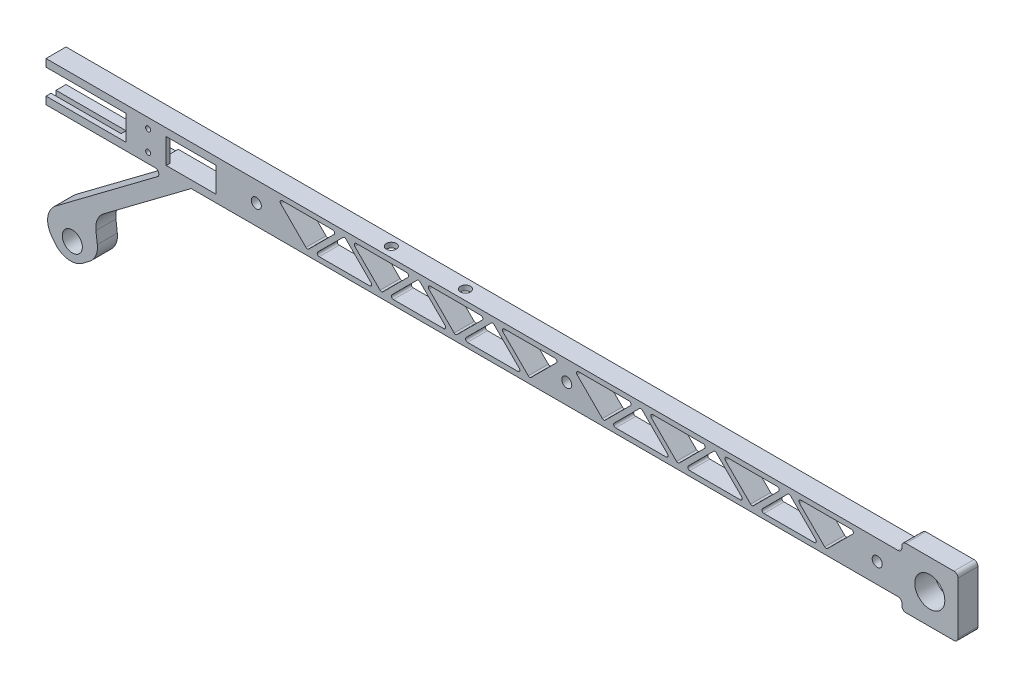
from build123d import *

# Parameters (mm, degrees)
BOSS_EXTRUDE1_DEPTH             = 12.7
CUT_EXTRUDE1_DEPTH              = 12.7
LPATTERN1_COUNT                 = 7
LPATTERN1_PITCH                 = 46.99
CUT_EXTRUDE2_DEPTH              = 12.7
LPATTERN2_COUNT                 = 8
LPATTERN2_PITCH                 = 46.99
BOSS_EXTRUDE3_DEPTH             = 12.7
SKETCH14_R                      = 3.175
CUT_EXTRUDE5_DEPTH              = 577.697477019
SKETCH15_W                      = 50.8
SKETCH15_H                      = 15.875
CUT_EXTRUDE6_DEPTH              = 577.697477019
SKETCH16_W                      = 3.175
SKETCH16_H                      = 22.225
CUT_EXTRUDE7_DEPTH              = 44.45
CUT_EXTRUDE8_DEPTH              = 10.16
SKETCH18_W                      = 31.75
SKETCH18_H                      = 15.875
CUT_EXTRUDE9_DEPTH              = 2.54
F_1_8_0_125_DIAMETER_HOLE1_D    = 3.175
BOSS_EXTRUDE4_DEPTH             = 12.7
F_1_4_0_25_DIAMETER_HOLE1_D     = 6.35
F_1_4_0_25_DIAMETER_HOLE2_D     = 6.35
F_1_4_0_25_DIAMETER_HOLE2_DEPTH = 3.175
F_1_4_0_25_DIAMETER_HOLE2_TIP   = 1.907732465
CUT_EXTRUDE10_DEPTH             = 12.7
SKETCH28_R                      = 6.35
BOSS_EXTRUDE5_DEPTH             = 12.7
CUT_EXTRUDE11_DEPTH             = 12.7
FILLET1_R                       = 12.7
BOSS_EXTRUDE7_START             = -12.7
SKETCH30_R                      = 3.175
BOSS_EXTRUDE7_DEPTH             = 12.7
SKETCH31_R                      = 9.525
CUT_EXTRUDE12_DEPTH             = 12.7
FILLET2_R                       = 2.54
FILLET5_R                       = 2.54


with BuildPart() as part:
    # Sketch1 → Boss-Extrude1 (new body)
    with BuildSketch(Plane.XY):
        with BuildLine():
            Line((2.54, 0), (568.96, 0))
            ThreePointArc((568.96, 0), (570.756051224, 0.743948776), (571.5, 2.54))
            Line((571.5, 2.54), (571.5, 22.86))
            ThreePointArc((571.5, 22.86), (570.756051224, 24.656051224), (568.96, 25.4))
            Line((568.96, 25.4), (2.54, 25.4))
            Line((2.54, 25.4), (0, 25.4))
            Line((0, 25.4), (0, 22.86))
            Line((0, 22.86), (0, 2.54))
            Line((0, 2.54), (0, 0))
            Line((0, 0), (2.54, 0))
        make_face()
    extrude(amount=BOSS_EXTRUDE1_DEPTH)

    # Sketch2 → Cut-Extrude1 (cut)
    with BuildSketch(Plane.XY):
        with BuildLine():
            Line((173.246051224, 3.175), (205.213948776, 3.175))
            ThreePointArc((205.213948776, 3.175), (206.387275782, 3.958992041), (206.111974388, 5.343025612))
            Line((206.111974388, 5.343025612), (190.128025612, 21.326974388))
            ThreePointArc((190.128025612, 21.326974388), (189.23, 21.698948776), (188.331974388, 21.326974388))
            Line((188.331974388, 21.326974388), (172.348025612, 5.343025612))
            ThreePointArc((172.348025612, 5.343025612), (172.072724218, 3.958992041), (173.246051224, 3.175))
        make_face()
    cut_extrude1 = extrude(amount=CUT_EXTRUDE1_DEPTH, mode=Mode.SUBTRACT)

    # LPattern1: Cut-Extrude1 ×7, 1 skipped
    with Locations(*[(i * LPATTERN1_PITCH, 0, 0) for i in range(1, LPATTERN1_COUNT) if i not in (3,)]):
        add(cut_extrude1, mode=Mode.SUBTRACT)

    # Sketch3 → Cut-Extrude2 (cut)
    with BuildSketch(Plane.XY):
        with BuildLine():
            Line((149.751051224, 22.225), (181.718948776, 22.225))
            ThreePointArc((181.718948776, 22.225), (182.892275782, 21.441007959), (182.616974388, 20.056974388))
            Line((182.616974388, 20.056974388), (166.633025612, 4.073025612))
            ThreePointArc((166.633025612, 4.073025612), (165.735, 3.701051224), (164.836974388, 4.073025612))
            Line((164.836974388, 4.073025612), (148.853025612, 20.056974388))
            ThreePointArc((148.853025612, 20.056974388), (148.577724218, 21.441007959), (149.751051224, 22.225))
        make_face()
    cut_extrude2 = extrude(amount=CUT_EXTRUDE2_DEPTH, mode=Mode.SUBTRACT)

    # LPattern2: Cut-Extrude2 ×8
    with Locations(*[(i * LPATTERN2_PITCH, 0, 0) for i in range(1, LPATTERN2_COUNT)]):
        add(cut_extrude2, mode=Mode.SUBTRACT)

    # Sketch8 → Boss-Extrude3 (add)
    with BuildSketch(Plane.XY):
        Polygon((92.075, 0), (-9.525, -76.2), (-15.24, -68.58), (76.2, 0), align=None)
    extrude(amount=BOSS_EXTRUDE3_DEPTH)

    # Sketch14 → Cut-Extrude5 (cut, through all)
    with BuildSketch(Plane(origin=(0, 0, 0), x_dir=(-1, 0, 0), z_dir=(0, 0, -1))):
        with Locations((-560.3875, 12.7)):
            Circle(SKETCH14_R)
    extrude(amount=-CUT_EXTRUDE5_DEPTH, mode=Mode.SUBTRACT)

    # Sketch15 → Cut-Extrude6 (cut, through all)
    with BuildSketch(Plane.XY.offset(12.7)):
        with Locations((25.4, 12.7)):
            Rectangle(SKETCH15_W, SKETCH15_H)
    extrude(amount=-CUT_EXTRUDE6_DEPTH, mode=Mode.SUBTRACT)

    # Sketch16 → Cut-Extrude7 (cut)
    with BuildSketch(Plane.ZY):
        with Locations((7.9375, 12.7)):
            Rectangle(SKETCH16_W, SKETCH16_H)
    extrude(amount=-CUT_EXTRUDE7_DEPTH, mode=Mode.SUBTRACT)

    # Sketch17 → Cut-Extrude8 (cut)
    with BuildSketch(Plane.XY):
        Polygon((50.8, 20.6375), (54.61, 20.6375), (55.88, 22.2885), (71.12, 22.2885), (71.12, 20.6375), (107.95, 20.6375), (107.95, 4.7625), (71.12, 4.7625), (71.12, 3.1115), (55.88, 3.1115), (54.61, 4.7625), (50.8, 4.7625), align=None)
    extrude(amount=CUT_EXTRUDE8_DEPTH, mode=Mode.SUBTRACT)

    # Sketch18 → Cut-Extrude9 (cut)
    with BuildSketch(Plane(origin=(0, 0, 10.16), x_dir=(-1, 0, 0), z_dir=(0, 0, -1))):
        with Locations((-92.075, 12.7)):
            Rectangle(SKETCH18_W, SKETCH18_H)
    extrude(amount=-CUT_EXTRUDE9_DEPTH, mode=Mode.SUBTRACT)

    # 1/8 (0.125) Diameter Hole1 (through all)
    with Locations(Plane(origin=(0, 0, 10.16), x_dir=(-1, 0, 0), z_dir=(0, 0, -1))):
        with Locations((-64.77, 19.1135), (-64.77, 6.2865)):
            Hole(F_1_8_0_125_DIAMETER_HOLE1_D / 2)

    # Sketch21 → Boss-Extrude4 (add)
    with BuildSketch(Plane(origin=(0, 0, 0), x_dir=(-1, 0, 0), z_dir=(0, 0, -1))):
        with BuildLine():
            Line((-76.2, 0), (-69.85, 0))
            ThreePointArc((-69.85, 0), (-71.419048922, -1.593650359), (-71.12, -3.81))
            Line((-71.12, -3.81), (-76.2, 0))
        make_face()
    extrude(amount=-BOSS_EXTRUDE4_DEPTH)

    # 1/4 (0.25) Diameter Hole1 (through all)
    with Locations(Plane.XY.offset(12.7)):
        with Locations((133.35, 12.7), (330.2, 12.7), (527.05, 12.7)):
            Hole(F_1_4_0_25_DIAMETER_HOLE1_D / 2)

    # 1/4 (0.25) Diameter Hole2
    with Locations(Plane(origin=(0, 25.4, 0), x_dir=(1, 0, 0), z_dir=(0, 1, 0))):
        with Locations((212.616051224, -6.35), (259.606051224, -6.35)):
            Hole(F_1_4_0_25_DIAMETER_HOLE2_D / 2, depth=F_1_4_0_25_DIAMETER_HOLE2_DEPTH)
            with Locations((0, 0, -(F_1_4_0_25_DIAMETER_HOLE2_DEPTH + F_1_4_0_25_DIAMETER_HOLE2_TIP / 2))):  # 118° drill point
                Cone(0, F_1_4_0_25_DIAMETER_HOLE2_D / 2, F_1_4_0_25_DIAMETER_HOLE2_TIP, mode=Mode.SUBTRACT)

    # Sketch26 → Cut-Extrude10 (cut)
    with BuildSketch(Plane.XY.offset(12.7)):
        Polygon((-9.525, -76.2), (1.651, -67.818), (-0.254, -65.278), (-11.43, -73.66), align=None)
    extrude(amount=-CUT_EXTRUDE10_DEPTH, mode=Mode.SUBTRACT)

    # Sketch28 → Boss-Extrude5 (add)
    with BuildSketch(Plane.XY.offset(12.7)):
        Polygon((1.651, -67.818), (13.081, -83.058), (33.401, -67.818), (30.769818102, -45.978886423), align=None)
        with Locations((16.6878, -66.7004)):
            Circle(SKETCH28_R, mode=Mode.SUBTRACT)
    extrude(amount=-BOSS_EXTRUDE5_DEPTH)

    # Sketch29 → Cut-Extrude11 (cut)
    with BuildSketch(Plane.XY.offset(12.7)):
        Polygon((-15.24, -68.58), (-11.43, -73.66), (-0.254, -65.278), (-4.064, -60.198), align=None)
    extrude(amount=-CUT_EXTRUDE11_DEPTH, mode=Mode.SUBTRACT)

    # Fillet1
    fillet1_edges = [part.edges().sort_by_distance(p)[0] for p in [
        (30.769818102, -45.978886423, 6.35),
        (33.401, -67.818, 6.35),
        (13.081, -83.058, 6.35),
        (-4.064, -60.198, 6.35),
    ]]
    fillet(fillet1_edges, radius=FILLET1_R)

    # Sketch30 → Boss-Extrude7 (add)
    with BuildSketch(Plane.XY.offset(12.7).offset(BOSS_EXTRUDE7_START)):
        Polygon((578.262851122, 12.7), (578.262851122, 31.75), (542.702851122, 31.75), (542.702851122, 25.4), (542.702851122, 0), (542.702851122, -6.35), (578.262851122, -6.35), align=None)
        with Locations(Location((560.3875, 12.7, 0), (0, 0, 180))):
            Circle(SKETCH30_R, mode=Mode.SUBTRACT)
    extrude(amount=BOSS_EXTRUDE7_DEPTH)

    # Sketch31 → Cut-Extrude12 (cut)
    with BuildSketch(Plane.XY.offset(12.7)):
        with Locations((560.3875, 12.7)):
            Circle(SKETCH31_R)
    extrude(amount=-CUT_EXTRUDE12_DEPTH, mode=Mode.SUBTRACT)

    # Fillet2
    fillet2_edges = [part.edges().sort_by_distance(p)[0] for p in [
        (578.262851122, 31.75, 6.35),
        (578.262851122, -6.35, 6.35),
    ]]
    fillet(fillet2_edges, radius=FILLET2_R)

    # Fillet5
    fillet5_edges = [part.edges().sort_by_distance(p)[0] for p in [
        (542.702851122, 25.4, 6.35),
        (542.702851122, -6.35, 6.35),
        (542.702851122, 31.75, 6.35),
        (542.702851122, 0, 6.35),
    ]]
    fillet(fillet5_edges, radius=FILLET5_R)


solid = part.part
